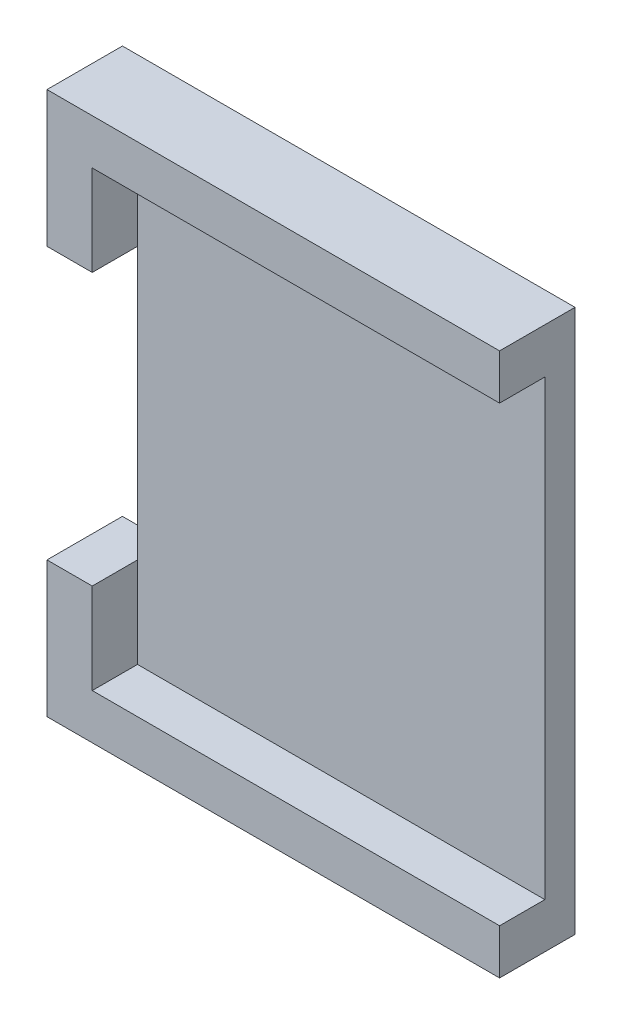
from build123d import *

# Parameters (mm, degrees)
BOSS_EXTRUDE1_DEPTH = 2
BOSS_EXTRUDE2_DEPTH = 5


with BuildPart() as part:
    # Sketch1 → Boss-Extrude1 (new body)
    with BuildSketch(Plane.XY):
        Polygon((15, 18), (-15, 18), (-15, 9), (-12, 9), (-12, -9), (-15, -9), (-15, -18), (15, -18), align=None)
    extrude(amount=BOSS_EXTRUDE1_DEPTH)

    # Sketch1<3> → Boss-Extrude2 (add)
    with BuildSketch(Plane.XY):
        Polygon((-15, 9), (-12, 9), (-12, 15), (15, 15), (15, 18), (-15, 18), align=None)
        Polygon((-12, -15), (-12, -9), (-15, -9), (-15, -18), (15, -18), (15, -15), align=None)
    extrude(amount=BOSS_EXTRUDE2_DEPTH)


solid = part.part
